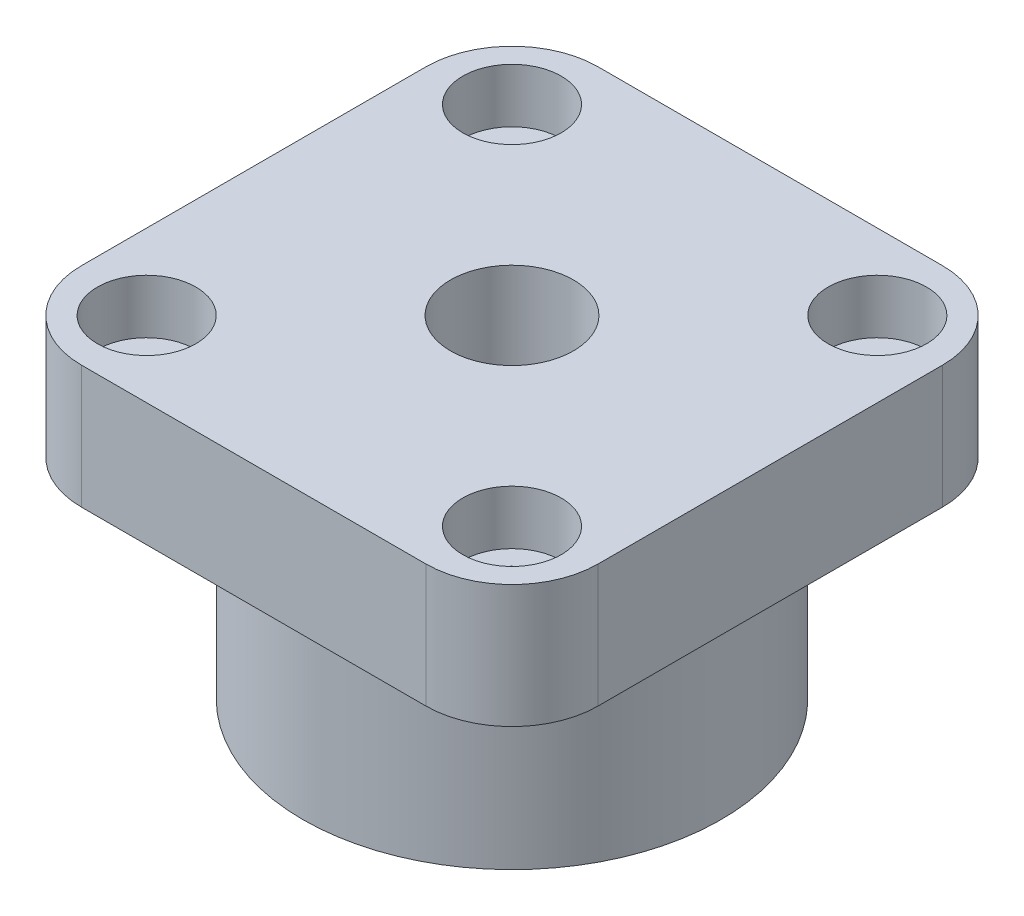
from build123d import *

# Parameters (mm, degrees)
SKETCH1_R                                           = 17
SKETCH1_R_2                                         = 5
BOSS_EXTRUDE1_DEPTH                                 = 17
SKETCH2_W                                           = 42
SKETCH2_H                                           = 42
SKETCH2_R                                           = 5
BOSS_EXTRUDE2_DEPTH                                 = 10
FILLET1_R                                           = 7
CBORE_FOR_M4_HEX_SOCKET_HEAD_CAP_SCREW1_D           = 4.5
CBORE_FOR_M4_HEX_SOCKET_HEAD_CAP_SCREW1_CBORE_D     = 8
CBORE_FOR_M4_HEX_SOCKET_HEAD_CAP_SCREW1_CBORE_DEPTH = 4.4


with BuildPart() as part:
    # Sketch1 → Boss-Extrude1 (new body)
    with BuildSketch(Plane(origin=(0, 0, 0), x_dir=(1, 0, 0), z_dir=(0, 1, 0))):
        with Locations(Location((0, 0, 0), (0, 0, 270))):
            Circle(SKETCH1_R)
        with Locations(Location((0, 0, 0), (0, 0, 270))):
            Circle(SKETCH1_R_2, mode=Mode.SUBTRACT)
    extrude(amount=BOSS_EXTRUDE1_DEPTH)

    # Sketch2 → Boss-Extrude2 (add)
    with BuildSketch(Plane(origin=(0, 17, 0), x_dir=(1, 0, 0), z_dir=(0, 1, 0))):
        Rectangle(SKETCH2_W, SKETCH2_H)
        with Locations(Location((0, 0, 0), (0, 0, 270))):
            Circle(SKETCH2_R, mode=Mode.SUBTRACT)
    extrude(amount=BOSS_EXTRUDE2_DEPTH)

    # Fillet1
    fillet1_edges = [part.edges().sort_by_distance(p)[0] for p in [
        (-21, 22, -21),
        (-21, 22, 21),
        (21, 22, 21),
        (21, 22, -21),
    ]]
    fillet(fillet1_edges, radius=FILLET1_R)

    # CBORE for M4 Hex Socket Head Cap Screw1 (through all)
    with Locations(Plane(origin=(-14.849242405, 27, -14.849242405), x_dir=(0, 0, 1), z_dir=(0, 1, 0))):
        with Locations((0, 0), (0, 29.69848481), (29.69848481, 29.69848481), (29.69848481, 0)):
            CounterBoreHole(CBORE_FOR_M4_HEX_SOCKET_HEAD_CAP_SCREW1_D / 2, CBORE_FOR_M4_HEX_SOCKET_HEAD_CAP_SCREW1_CBORE_D / 2, CBORE_FOR_M4_HEX_SOCKET_HEAD_CAP_SCREW1_CBORE_DEPTH)


solid = part.part
